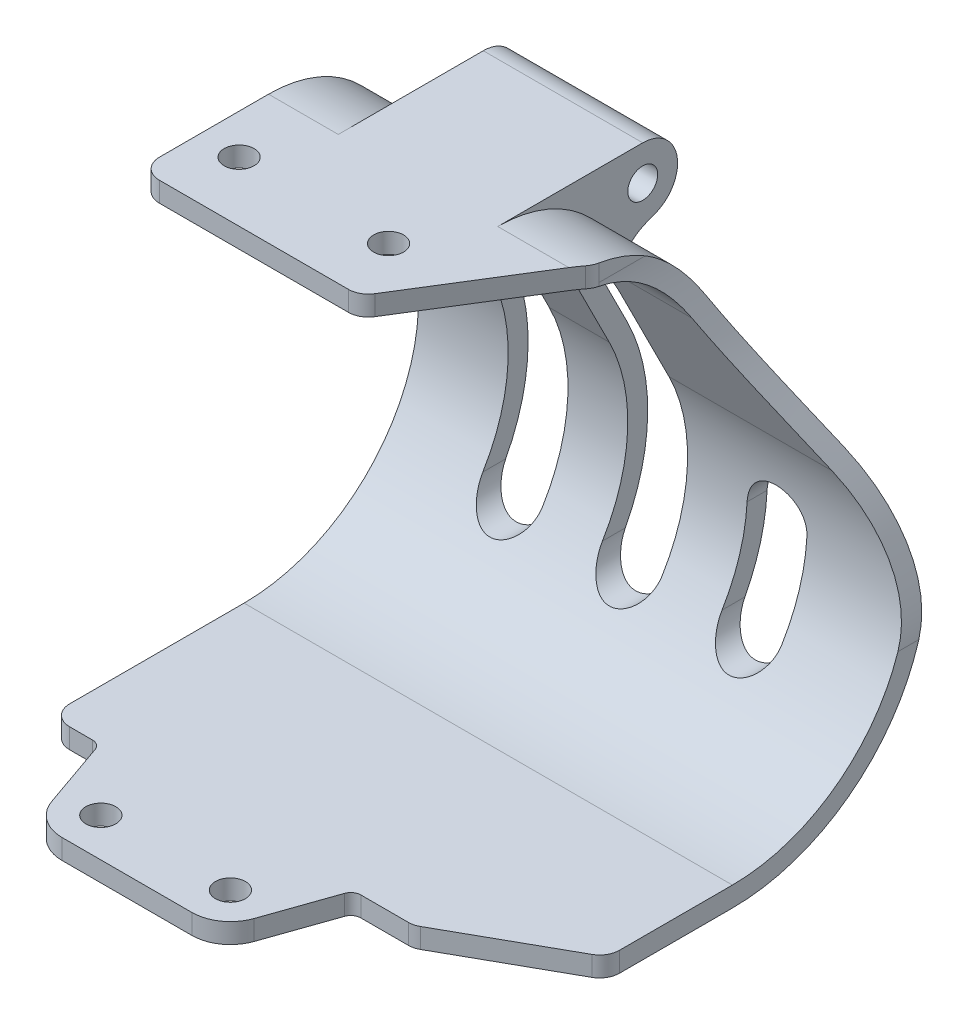
from build123d import *

# Parameters (mm, degrees)
BOSS_EXTRUDE2_DEPTH     = 49
SKETCH5_R               = 1.5
CUT_EXTRUDE1_DEPTH      = 2
SKETCH10_R              = 1.5
BOSS_EXTRUDE5_DEPTH     = 16
CUT_EXTRUDE3_DEPTH      = 61.885750342
CUT_EXTRUDE3_DEPTH_BACK = 61.885750342
SKETCH11_R              = 1.5
CUT_EXTRUDE4_DEPTH      = 10


with BuildPart() as part:
    # Sketch3 → Boss-Extrude2 (new body)
    with BuildSketch(Plane(origin=(0, 0, 0), x_dir=(0, 0, -1), z_dir=(1, 0, 0))):
        with BuildLine():
            ThreePointArc((19.040237549, 3.777574094), (20.514676318, -0.265294274), (21.015183191, -4.539431286))
            Line((21.015183191, -4.539431286), (21.015183191, 1.624982717))
            ThreePointArc((21.015183191, 1.624982717), (20.521401189, 2.945628061), (19.93348373, 4.227141952))
            Line((19.93348373, 4.227141952), (13.613668573, 16.783979929))
            ThreePointArc((13.613668573, 16.783979929), (8.807358727, 22.022356561), (1.967436379, 23.960568714))
            Line((1.967436379, 23.960568714), (-10.984816809, 23.960568714))
            Line((-10.984816809, 23.960568714), (-10.984816809, 22.960568714))
            Line((-10.984816809, 22.960568714), (1.967436379, 22.960568714))
            ThreePointArc((1.967436379, 22.960568714), (8.282748328, 21.171014134), (12.720422391, 16.334412071))
            Line((12.720422391, 16.334412071), (19.040237549, 3.777574094))
        make_face()
        with BuildLine():
            Line((-26.984816809, -22.039431286), (-26.984816809, -23.039431286))
            Line((-26.984816809, -23.039431286), (2.515183191, -23.039431286))
            ThreePointArc((2.515183191, -23.039431286), (15.596658643, -17.620906738), (21.015183191, -4.539431286))
            ThreePointArc((21.015183191, -4.539431286), (20.514676318, -0.265294274), (19.040237549, 3.777574094))
            Line((19.040237549, 3.777574094), (12.720422391, 16.334412071))
            ThreePointArc((12.720422391, 16.334412071), (8.282748328, 21.171014134), (1.967436379, 22.960568714))
            Line((1.967436379, 22.960568714), (-10.984816809, 22.960568714))
            Line((-10.984816809, 22.960568714), (-10.984816809, 21.960568714))
            Line((-10.984816809, 21.960568714), (1.967436379, 21.960568714))
            ThreePointArc((1.967436379, 21.960568714), (7.758137929, 20.319671706), (11.82717621, 15.884844213))
            Line((11.82717621, 15.884844213), (18.146991367, 3.328006236))
            ThreePointArc((18.146991367, 3.328006236), (17.413675676, -13.72011327), (2.515183191, -22.039431286))
            Line((2.515183191, -22.039431286), (-26.984816809, -22.039431286))
        make_face()
        with BuildLine():
            Line((2.515183191, -23.039431286), (-26.984816809, -23.039431286))
            Line((-26.984816809, -23.039431286), (-26.984816809, -24.039431286))
            Line((-26.984816809, -24.039431286), (2.515183191, -24.039431286))
            ThreePointArc((2.515183191, -24.039431286), (18.333780997, -15.942148658), (21.015183191, 1.624982717))
            Line((21.015183191, 1.624982717), (21.015183191, -4.539431286))
            ThreePointArc((21.015183191, -4.539431286), (15.596658643, -17.620906738), (2.515183191, -23.039431286))
        make_face()
    extrude(amount=BOSS_EXTRUDE2_DEPTH)

    # Sketch5 → Cut-Extrude1 (cut)
    with BuildSketch(Plane.XZ.offset(24.039431286)):
        with BuildLine():
            ThreePointArc((0, 14.984816809), (0.585786438, 16.399030371), (2, 16.984816809))
            Line((2, 16.984816809), (4.290518995, 16.984816809))
            ThreePointArc((4.290518995, 16.984816809), (4.86915946, 17.169234065), (5.234377351, 17.654466384))
            Line((5.234377351, 17.654466384), (7.591536332, 24.389206329))
            ThreePointArc((7.591536332, 24.389206329), (9.007147454, 26.270002106), (11.25, 26.984816809))
            Line((11.25, 26.984816809), (0, 26.984816809))
            Line((0, 26.984816809), (0, 14.984816809))
        make_face()
        with Locations(Location((11.25, 23.108744045, 0), (0, 0, 270))):
            Circle(SKETCH5_R)
        with Locations(Location((24.25, 23.108744045, 0), (0, 0, 270))):
            Circle(SKETCH5_R)
        with BuildLine():
            Line((49, 26.984816809), (24.25, 26.984816809))
            ThreePointArc((24.25, 26.984816809), (26.492852546, 26.270002106), (27.908463668, 24.389206329))
            Line((27.908463668, 24.389206329), (30.265622649, 17.654466384))
            ThreePointArc((30.265622649, 17.654466384), (30.63084054, 17.169234065), (31.209481005, 16.984816809))
            Line((31.209481005, 16.984816809), (35.978128919, 16.984816809))
            ThreePointArc((35.978128919, 16.984816809), (36.483092253, 16.920020165), (36.955335657, 16.729828841))
            Line((36.955335657, 16.729828841), (47.977206738, 10.557581035))
            ThreePointArc((47.977206738, 10.557581035), (48.725458414, 9.823901423), (49, 8.812569004))
            Line((49, 8.812569004), (49, 26.984816809))
        make_face()
    extrude(amount=-CUT_EXTRUDE1_DEPTH, mode=Mode.SUBTRACT)

    # Sketch10 → Boss-Extrude5 (add)
    with BuildSketch(Plane.ZY.offset(-10)):
        with BuildLine():
            ThreePointArc((-13.613668573, 16.783979929), (-8.807358727, 22.022356561), (-1.967436379, 23.960568714))
            Line((-1.967436379, 23.960568714), (-16.515183191, 23.960568714))
            ThreePointArc((-16.515183191, 23.960568714), (-19.967688819, 21.035203288), (-17.648856962, 17.149257224))
            add(Edge.make_bspline(
                [(-17.648856962, 17.149257224), (-16.276182006, 16.679302768), (-15.072352654, 16.047388146), (-14.653006488, 14.71891988)],
                knots=[0, 0, 0, 0, 1, 1, 1, 1], degree=3))
            Line((-14.653006488, 14.71891988), (-13.613668573, 16.783979929))
        make_face()
        with Locations((-16.515183191, 20.460568714)):
            Circle(SKETCH10_R, mode=Mode.SUBTRACT)
    extrude(amount=-BOSS_EXTRUDE5_DEPTH)

    # Sketch7 → Cut-Extrude3 (cut, two sides: drawn at the far end of the back side and taken through both)
    with BuildSketch(Plane.XY.offset(-CUT_EXTRUDE3_DEPTH_BACK)):
        with BuildLine():
            Line((34.080665872, 23.960568714), (34.080665872, 22.092897227))
            add(Edge.make_bspline(
                [(34.080665872, 22.092897227), (34.080665872, 12.090283147), (49, 0.040376418), (49, -10.060540055)],
                knots=[0, 0, 0, 0, 1, 1, 1, 1], degree=3))
            Line((49, -10.060540055), (49, 23.960568714))
            Line((49, 23.960568714), (34.080665872, 23.960568714))
        make_face()
        with BuildLine():
            Line((39, -13.626094713), (39, -5.473517773))
            ThreePointArc((39, -5.473517773), (36, -2.473517773), (33, -5.473517773))
            Line((33, -5.473517773), (33, -13.626094713))
            ThreePointArc((33, -13.626094713), (36, -16.626094713), (39, -13.626094713))
        make_face()
        with BuildLine():
            Line((21, 13.285353535), (21, -13.626094713))
            ThreePointArc((21, -13.626094713), (24, -16.626094713), (27, -13.626094713))
            Line((27, -13.626094713), (27, 13.285353535))
            ThreePointArc((27, 13.285353535), (24, 16.285353535), (21, 13.285353535))
        make_face()
        with BuildLine():
            Line((9, 13.285353535), (9, -13.626094713))
            ThreePointArc((9, -13.626094713), (12, -16.626094713), (15, -13.626094713))
            Line((15, -13.626094713), (15, 13.285353535))
            ThreePointArc((15, 13.285353535), (12, 16.285353535), (9, 13.285353535))
        make_face()
        with BuildLine():
            ThreePointArc((0.75, 14.13429512), (0.219669914, 13.914625206), (0, 13.38429512))
            Line((0, 13.38429512), (0, 23.960568714))
            Line((0, 23.960568714), (3, 23.960568714))
            Line((3, 23.960568714), (3, 14.88429512))
            ThreePointArc((3, 14.88429512), (2.780330086, 14.353965035), (2.25, 14.13429512))
            Line((2.25, 14.13429512), (0.75, 14.13429512))
        make_face()
    extrude(amount=CUT_EXTRUDE3_DEPTH + CUT_EXTRUDE3_DEPTH_BACK, mode=Mode.SUBTRACT)

    # Sketch11 → Cut-Extrude4 (cut)
    with BuildSketch(Plane(origin=(0, 23.960568714, 0), x_dir=(1, 0, 0), z_dir=(0, 1, 0))):
        with Locations(Location((7, -4.984816809, 0), (0, 0, 270))):
            Circle(SKETCH11_R)
        with BuildLine():
            Line((3, -10.984816809), (5, -10.984816809))
            ThreePointArc((5, -10.984816809), (3.585786438, -10.399030371), (3, -8.984816809))
            Line((3, -8.984816809), (3, -10.984816809))
        make_face()
        with Locations(Location((22, -4.984816809, 0), (0, 0, 270))):
            Circle(SKETCH11_R)
        with BuildLine():
            ThreePointArc((25.667603226, -10.040984883), (24.940729121, -10.733006751), (23.969218994, -10.984816809))
            Line((23.969218994, -10.984816809), (34.080665872, -10.984816809))
            Line((34.080665872, -10.984816809), (34.080665872, 1.967436379))
            Line((34.080665872, 1.967436379), (33.13523683, 1.967436379))
            Line((33.13523683, 1.967436379), (25.667603226, -10.040984883))
        make_face()
        with BuildLine():
            Line((34.080665872, 1.967436379), (34.080665872, -10.984816809))
            Line((34.080665872, -10.984816809), (35.220431161, -10.984816809))
            Line((35.220431161, -10.984816809), (35.220431161, 4.058896411))
            Line((35.220431161, 4.058896411), (34.080665872, 4.058896411))
            ThreePointArc((34.080665872, 4.058896411), (34.003784233, 3.509700846), (33.779050104, 3.002728336))
            Line((33.779050104, 3.002728336), (33.13523683, 1.967436379))
            Line((33.13523683, 1.967436379), (34.080665872, 1.967436379))
        make_face()
    extrude(amount=-CUT_EXTRUDE4_DEPTH, mode=Mode.SUBTRACT)


solid = part.part
